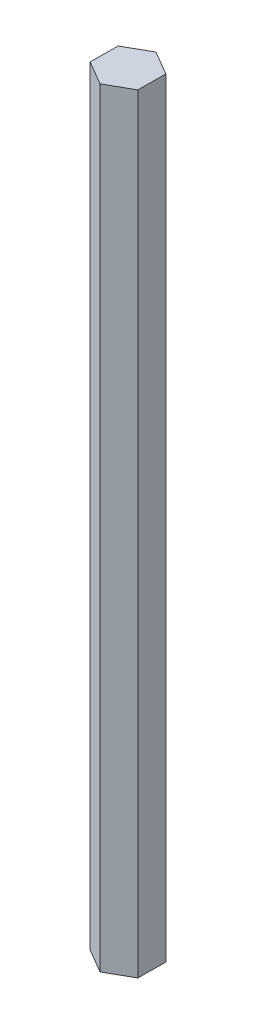
from build123d import *

# Parameters (mm, degrees)
BOSS_EXTRUDE1_DEPTH = 203.2


with BuildPart() as part:
    # Sketch1 → Boss-Extrude1 (new body)
    with BuildSketch(Plane(origin=(0, 0, 0), x_dir=(1, 0, 0), z_dir=(0, 1, 0))):
        Polygon((-6.37777266, -3.617644156), (-0.055914589, -7.332135221), (6.32185807, -3.714491065), (6.37777266, 3.617644156), (0.055914589, 7.332135221), (-6.32185807, 3.714491065), align=None)
    extrude(amount=BOSS_EXTRUDE1_DEPTH)


solid = part.part
